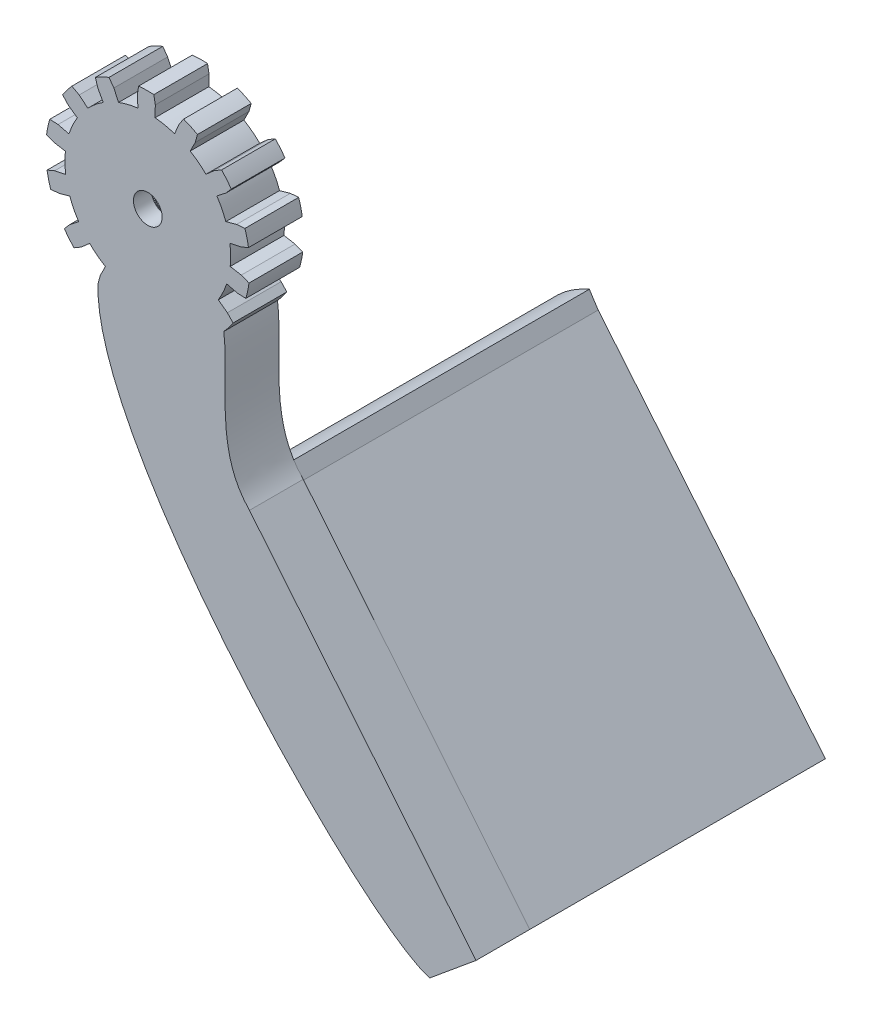
from build123d import *

# Parameters (mm, degrees)
BOSS_EXTRUDE1_DEPTH      = 2
BOSS_EXTRUDE1_DEPTH_BACK = 4
SKETCH3_R                = 3.5
BOSS_EXTRUDE2_DEPTH      = 2
BOSS_EXTRUDE3_START      = -6
BOSS_EXTRUDE3_DEPTH      = 6
BOSS_EXTRUDE4_DEPTH      = 33
CUT_EXTRUDE1_DEPTH       = 4
SKETCH8_R                = 1.6
CUT_EXTRUDE2_DEPTH       = 8


with BuildPart() as part:
    # Sketch2 → Boss-Extrude1 (new, two sides: drawn at the far end of the back side and taken through both)
    with BuildSketch(Plane.XY.offset(-BOSS_EXTRUDE1_DEPTH_BACK)):
        with BuildLine():
            Line((17.68781088, 7.309984121), (18.627860573, 8.138033693))
            Line((18.627860573, 8.138033693), (19.430379653, 8.604441903))
            ThreePointArc((19.430379653, 8.604441903), (19.995203762, 7.96839095), (20.511027992, 7.291994282))
            Line((20.511027992, 7.291994282), (19.899268666, 6.593908315))
            Line((19.899268666, 6.593908315), (18.906195626, 5.830255607))
            ThreePointArc((18.906195626, 5.830255607), (19.464749307, 4.865356726), (19.903157697, 3.840266414))
            Line((19.903157697, 3.840266414), (21.109390449, 4.178441024))
            Line((21.109390449, 4.178441024), (22.034802094, 4.250460322))
            ThreePointArc((22.034802094, 4.250460322), (22.267718866, 3.432330219), (22.438982924, 2.599110133))
            Line((22.438982924, 2.599110133), (21.584918666, 2.235588834))
            Line((21.584918666, 2.235588834), (20.358854282, 1.978439762))
            ThreePointArc((20.358854282, 1.978439762), (20.443439825, 0.86674855), (20.393662118, -0.24704418))
            Line((20.393662118, -0.24704418), (21.62716874, -0.465724161))
            Line((21.62716874, -0.465724161), (22.492183824, -0.80235808))
            ThreePointArc((22.492183824, -0.80235808), (22.347061236, -1.640526633), (22.139844174, -2.465540681))
            Line((22.139844174, -2.465540681), (21.212632886, -2.42249746))
            Line((21.212632886, -2.42249746), (19.996414245, -2.12221137))
            ThreePointArc((19.996414245, -2.12221137), (19.590278446, -3.160510834), (19.062173728, -4.142405671))
            Line((19.062173728, -4.142405671), (20.078643104, -4.874627991))
            Line((20.078643104, -4.874627991), (20.711934781, -5.553240651))
            ThreePointArc((20.711934781, -5.553240651), (20.217516142, -6.245438093), (19.672859841, -6.898841951))
            Line((19.672859841, -6.898841951), (18.85614709, -6.457759449))
            Line((18.85614709, -6.457759449), (17.89066121, -5.659513538))
            ThreePointArc((17.89066121, -5.659513538), (17.074244245, -6.418773312), (16.172410131, -7.074293942))
            Line((16.172410131, -7.074293942), (16.770518037, -8.175032991))
            Line((16.770518037, -8.175032991), (17.046655123, -9.061216832))
            ThreePointArc((17.046655123, -9.061216832), (16.300866108, -9.470344969), (15.526646427, -9.822723991))
            Line((15.526646427, -9.822723991), (14.98219219, -9.070964007))
            Line((14.98219219, -9.070964007), (14.45866539, -7.932860668))
            ThreePointArc((14.45866539, -7.932860668), (13.393668651, -8.262700042), (12.296724449, -8.462012564))
            Line((12.296724449, -8.462012564), (12.358008277, -9.713253473))
            Line((12.358008277, -9.713253473), (12.222298437, -10.631488917))
            ThreePointArc((12.222298437, -10.631488917), (11.372851706, -10.676514905), (10.52241235, -10.658076103))
            Line((10.52241235, -10.658076103), (10.358052465, -9.744533921))
            Line((10.358052465, -9.744533921), (10.380175648, -8.491988479))
            ThreePointArc((10.380175648, -8.491988479), (9.277534802, -8.327078719), (8.202743763, -8.030706845))
            Line((8.202743763, -8.030706845), (7.7150655, -9.184626007))
            Line((7.7150655, -9.184626007), (7.194387732, -9.953045262))
            ThreePointArc((7.194387732, -9.953045262), (6.409526628, -9.625051151), (5.65130754, -9.239446557))
            Line((5.65130754, -9.239446557), (5.899595498, -8.34506041))
            Line((5.899595498, -8.34506041), (6.462986898, -7.226154851))
            ThreePointArc((6.462986898, -7.226154851), (5.541093486, -6.599158358), (4.701331158, -5.865802171))
            Line((4.701331158, -5.865802171), (3.761281465, -6.693851744))
            Line((3.761281465, -6.693851744), (2.958762386, -7.160259953))
            ThreePointArc((2.958762386, -7.160259953), (2.393938277, -6.524209001), (1.878114046, -5.847812333))
            Line((1.878114046, -5.847812333), (2.489873373, -5.149726366))
            Line((2.489873373, -5.149726366), (3.482946412, -4.386073658))
            ThreePointArc((3.482946412, -4.386073658), (2.924392731, -3.421174777), (2.485984341, -2.396084465))
            Line((2.485984341, -2.396084465), (1.279751589, -2.734259075))
            Line((1.279751589, -2.734259075), (0.354339945, -2.806278373))
            ThreePointArc((0.354339945, -2.806278373), (0.121423172, -1.98814827), (-0.049840885, -1.154928184))
            Line((-0.049840885, -1.154928184), (0.804223372, -0.791406885))
            Line((0.804223372, -0.791406885), (2.030287756, -0.534257812))
            ThreePointArc((2.030287756, -0.534257812), (1.945702213, 0.577433399), (1.99547992, 1.691226129))
            Line((1.99547992, 1.691226129), (0.761973298, 1.90990611))
            Line((0.761973298, 1.90990611), (-0.103041785, 2.24654003))
            ThreePointArc((-0.103041785, 2.24654003), (0.042080802, 3.084708583), (0.249297864, 3.90972263))
            Line((0.249297864, 3.90972263), (1.176509152, 3.86667941))
            Line((1.176509152, 3.86667941), (2.392727793, 3.566393319))
            ThreePointArc((2.392727793, 3.566393319), (2.798863592, 4.604692783), (3.32696831, 5.58658762))
            Line((3.32696831, 5.58658762), (2.310498934, 6.31880994))
            Line((2.310498934, 6.31880994), (1.677207257, 6.9974226))
            ThreePointArc((1.677207257, 6.9974226), (2.171625896, 7.689620042), (2.716282197, 8.3430239))
            Line((2.716282197, 8.3430239), (3.532994948, 7.901941399))
            Line((3.532994948, 7.901941399), (4.498480829, 7.103695488))
            ThreePointArc((4.498480829, 7.103695488), (5.314897794, 7.862955261), (6.216731907, 8.518475892))
            Line((6.216731907, 8.518475892), (5.618624002, 9.61921494))
            Line((5.618624002, 9.61921494), (5.342486915, 10.505398781))
            ThreePointArc((5.342486915, 10.505398781), (6.088275931, 10.914526918), (6.862495611, 11.26690594))
            Line((6.862495611, 11.26690594), (7.406949848, 10.515145956))
            Line((7.406949848, 10.515145956), (7.930476649, 9.377042617))
            ThreePointArc((7.930476649, 9.377042617), (8.995473387, 9.706881991), (10.092417589, 9.906194514))
            Line((10.092417589, 9.906194514), (10.031133761, 11.157435422))
            Line((10.031133761, 11.157435422), (10.166843601, 12.075670866))
            ThreePointArc((10.166843601, 12.075670866), (11.016290332, 12.120696854), (11.866729689, 12.102258053))
            Line((11.866729689, 12.102258053), (12.031089574, 11.18871587))
            Line((12.031089574, 11.18871587), (12.00896639, 9.936170428))
            ThreePointArc((12.00896639, 9.936170428), (13.111607236, 9.771260668), (14.186398275, 9.474888794))
            Line((14.186398275, 9.474888794), (14.674076538, 10.628807956))
            Line((14.674076538, 10.628807956), (15.194754306, 11.397227211))
            ThreePointArc((15.194754306, 11.397227211), (15.97961541, 11.069233101), (16.737834498, 10.683628507))
            Line((16.737834498, 10.683628507), (16.48954654, 9.789242359))
            Line((16.48954654, 9.789242359), (15.92615514, 8.6703368))
            ThreePointArc((15.92615514, 8.6703368), (16.848048552, 8.043340307), (17.68781088, 7.309984121))
        make_face()
    extrude(amount=BOSS_EXTRUDE1_DEPTH + BOSS_EXTRUDE1_DEPTH_BACK)

    # Sketch3 → Boss-Extrude2 (add)
    with BuildSketch(Plane.XY.offset(2)):
        with Locations((11.194571019, 0)):
            Circle(SKETCH3_R)
    extrude(amount=-BOSS_EXTRUDE2_DEPTH)

    # Sketch5 → Boss-Extrude3 (add)
    with BuildSketch(Plane.XY.offset(2).offset(BOSS_EXTRUDE3_START)):
        with BuildLine():
            Line((22.542404023, -22.747020906), (47.835171183, -53.618399108))
            Line((47.835171183, -53.618399108), (42.65918527, -57.902143879))
            add(Edge.make_bspline(
                [(42.65918527, -57.902143879), (34.794811104, -55.712489154), (4.891267532, -24.238927446), (5.65130754, -9.239446557)],
                knots=[0.222415535, 0.222415535, 0.222415535, 0.222415535, 1, 1, 1, 1], degree=3))
            ThreePointArc((5.65130754, -9.239446557), (6.409526628, -9.625051151), (7.194387732, -9.953045262))
            Line((7.194387732, -9.953045262), (7.7150655, -9.184626007))
            Line((7.7150655, -9.184626007), (8.202743763, -8.030706845))
            ThreePointArc((8.202743763, -8.030706845), (9.277534802, -8.327078719), (10.380175648, -8.491988479))
            Line((10.380175648, -8.491988479), (10.358052465, -9.744533921))
            Line((10.358052465, -9.744533921), (10.52241235, -10.658076103))
            ThreePointArc((10.52241235, -10.658076103), (11.372851706, -10.676514905), (12.222298437, -10.631488917))
            Line((12.222298437, -10.631488917), (12.358008277, -9.713253473))
            Line((12.358008277, -9.713253473), (12.296724449, -8.462012564))
            ThreePointArc((12.296724449, -8.462012564), (13.393668651, -8.262700042), (14.45866539, -7.932860668))
            Line((14.45866539, -7.932860668), (14.98219219, -9.070964007))
            Line((14.98219219, -9.070964007), (15.526646427, -9.822723991))
            ThreePointArc((15.526646427, -9.822723991), (16.300866108, -9.470344969), (17.046655123, -9.061216832))
            Line((17.046655123, -9.061216832), (16.770518037, -8.175032991))
            Line((16.770518037, -8.175032991), (16.172410131, -7.074293942))
            ThreePointArc((16.172410131, -7.074293942), (17.074244245, -6.418773312), (17.89066121, -5.659513538))
            Line((17.89066121, -5.659513538), (18.85614709, -6.457759449))
            Line((18.85614709, -6.457759449), (19.672859841, -6.898841951))
            add(Edge.make_bspline(
                [(19.672859841, -6.898841951), (20.322867091, -11.683356686), (18.562502786, -18.688266362), (22.542404023, -22.747020906)],
                knots=[0, 0, 0, 0, 1, 1, 1, 1], degree=3))
        make_face()
    extrude(amount=BOSS_EXTRUDE3_DEPTH)

    # Sketch6 → Boss-Extrude4 (add)
    with BuildSketch(Plane(origin=(0, 0, -4), x_dir=(-1, 0, 0), z_dir=(0, 0, -1))):
        with BuildLine():
            Line((-47.835171183, -53.618399108), (-22.469898408, -22.92528889))
            Line((-22.469898408, -22.92528889), (-21.484256134, -21.405340801))
            add(Edge.make_bspline(
                [(-21.484256134, -21.405340801), (-15.460770385, -24.043546847), (-14.934229825, -30.624048993)],
                knots=[0, 0, 0, 1, 1, 1], degree=2))
            add(Edge.make_bspline(
                [(-42.65918527, -57.902143879), (-37.740593552, -56.532674756), (-24.201184644, -43.708544884), (-14.934229825, -30.624048993)],
                knots=[0.222415535, 0.222415535, 0.222415535, 0.222415535, 0.708737832, 0.708737832, 0.708737832, 0.708737832], degree=3))
            Line((-42.65918527, -57.902143879), (-47.835171183, -53.618399108))
        make_face()
    extrude(amount=BOSS_EXTRUDE4_DEPTH)

    # Sketch7 → Cut-Extrude1 (cut)
    with BuildSketch(Plane(origin=(0, 0, -4), x_dir=(-1, 0, 0), z_dir=(0, 0, -1))):
        Polygon((-13.207057808, 2.867806466), (-13.172917327, 2.703541424), (-13.33711561, 2.738001552), (-13.29272821, 2.576204348), (-13.458766254, 2.600286381), (-13.404307112, 2.441595556), (-13.571529641, 2.455204453), (-13.507213682, 2.300246285), (-13.674960745, 2.303328339), (-13.601041796, 2.152714379), (-13.768651372, 2.145257426), (-13.685421156, 1.999582076), (-13.852231767, 1.981615546), (-13.760018756, 1.841453722), (-13.925372077, 1.813048519), (-13.824540193, 1.678953375), (-13.98778365, 1.640221603), (-13.878730831, 1.512722352), (-14.039220176, 1.463816866), (-13.922376803, 1.343416689), (-14.079478658, 1.284530498), (-13.95530586, 1.171704559), (-14.108400216, 1.103070059), (-13.977388045, 0.99826363), (-14.125870708, 0.920151691), (-13.988536209, 0.823778397), (-14.131821186, 0.736497289), (-13.988706357, 0.64893747), (-14.126228168, 0.552831654), (-13.977897817, 0.474430869), (-14.109113725, 0.36987963), (-13.956153244, 0.300947291), (-14.080545402, 0.188363245), (-13.923558455, 0.129171395), (-14.040635943, 0.00899886), (-13.880242087, -0.040218896), (-13.989542853, -0.167505654), (-13.82637509, -0.206555076), (-13.927467774, -0.340453716), (-13.762170052, -0.369180694), (-13.854655687, -0.509162777), (-13.68788036, -0.527453939), (-13.771393949, -0.672967021), (-13.603799203, -0.68075018), (-13.678011155, -0.831219986), (-13.510258411, -0.828464427), (-13.574875845, -0.983297122), (-13.407627145, -0.970013718), (-13.462395046, -1.128598248), (-13.296310446, -1.104839423), (-13.34101267, -1.266549928), (-13.176747628, -1.232409447), (-13.211207756, -1.396607729), (-13.049410552, -1.352220329), (-13.073492585, -1.518258373), (-12.914801759, -1.463799231), (-12.928410657, -1.63102176), (-12.773452489, -1.566705802), (-12.776534543, -1.734452865), (-12.625920582, -1.660533915), (-12.618463629, -1.828143492), (-12.47278828, -1.744913276), (-12.454821749, -1.911723887), (-12.314659926, -1.819510876), (-12.286254723, -1.984864197), (-12.152159579, -1.884032313), (-12.113427807, -2.047275769), (-11.985928555, -1.93822295), (-11.93702307, -2.098712295), (-11.816622893, -1.981868923), (-11.757736701, -2.138970778), (-11.644910762, -2.01479798), (-11.576276262, -2.167892335), (-11.471469834, -2.036880164), (-11.393357895, -2.185362827), (-11.2969846, -2.048028329), (-11.209703493, -2.191313306), (-11.122143674, -2.048198477), (-11.026037858, -2.185720288), (-10.947637073, -2.037389936), (-10.843085834, -2.168605845), (-10.774153494, -2.015645364), (-10.661569448, -2.140037521), (-10.602377599, -1.983050575), (-10.482205064, -2.100128063), (-10.432987308, -1.939734207), (-10.305700549, -2.049034973), (-10.266651127, -1.88586721), (-10.132752488, -1.986959894), (-10.10402551, -1.821662171), (-9.964043427, -1.914147807), (-9.945752264, -1.74737248), (-9.800239183, -1.830886069), (-9.792456023, -1.663291323), (-9.641986217, -1.737503275), (-9.644741777, -1.56975053), (-9.489909082, -1.634367964), (-9.503192486, -1.467119265), (-9.344607956, -1.521887166), (-9.368366781, -1.355802565), (-9.206656276, -1.400504789), (-9.240796757, -1.236239748), (-9.076598474, -1.270699875), (-9.120985874, -1.108902672), (-8.95494783, -1.132984705), (-9.009406972, -0.974293879), (-8.842184443, -0.987902777), (-8.906500402, -0.832944609), (-8.738753339, -0.836026663), (-8.812672288, -0.685412702), (-8.645062712, -0.677955749), (-8.728292928, -0.5322804), (-8.561482317, -0.514313869), (-8.653695328, -0.374152045), (-8.488342007, -0.345746842), (-8.589173891, -0.211651699), (-8.425930434, -0.172919926), (-8.534983253, -0.045420675), (-8.374493908, 0.003484811), (-8.491337281, 0.123884988), (-8.334235426, 0.182771179), (-8.458408224, 0.295597118), (-8.305313868, 0.364231618), (-8.436326039, 0.469038046), (-8.287843376, 0.547149986), (-8.425177875, 0.64352328), (-8.281892898, 0.730804387), (-8.425007727, 0.818364206), (-8.287485916, 0.914470022), (-8.435816268, 0.992870808), (-8.304600359, 1.097422047), (-8.45756084, 1.166354386), (-8.333168682, 1.278938432), (-8.490155629, 1.338130281), (-8.373078141, 1.458302817), (-8.533471997, 1.507520572), (-8.424171231, 1.634807331), (-8.587338994, 1.673856753), (-8.48624631, 1.807755392), (-8.651544032, 1.836482371), (-8.559058397, 1.976464454), (-8.725833724, 1.994755616), (-8.642320135, 2.140268697), (-8.809914881, 2.148051857), (-8.735702929, 2.298521663), (-8.903455673, 2.295766103), (-8.838838239, 2.450598799), (-9.006086939, 2.437315394), (-8.951319038, 2.595899925), (-9.117403638, 2.572141099), (-9.072701414, 2.733851605), (-9.236966456, 2.699711124), (-9.202506328, 2.863909406), (-9.364303532, 2.819522006), (-9.340221499, 2.98556005), (-9.498912325, 2.931100908), (-9.485303427, 3.098323437), (-9.640261595, 3.034007478), (-9.637179541, 3.201754542), (-9.787793502, 3.127835592), (-9.795250455, 3.295445169), (-9.940925804, 3.212214952), (-9.958892335, 3.379025564), (-10.099054159, 3.286812552), (-10.127459361, 3.452165873), (-10.261554505, 3.351333989), (-10.300286278, 3.514577446), (-10.427785529, 3.405524627), (-10.476691014, 3.566013972), (-10.597091192, 3.4491706), (-10.655977383, 3.606272454), (-10.768803322, 3.482099656), (-10.837437822, 3.635194012), (-10.94224425, 3.504181841), (-11.020356189, 3.652664504), (-11.116729484, 3.515330006), (-11.204010591, 3.658614983), (-11.29157041, 3.515500153), (-11.387676226, 3.653021964), (-11.466077011, 3.504691613), (-11.57062825, 3.635907522), (-11.63956059, 3.48294704), (-11.752144636, 3.607339198), (-11.811336485, 3.450352252), (-11.93150902, 3.567429739), (-11.980726776, 3.407035884), (-12.108013535, 3.51633665), (-12.147062957, 3.353168886), (-12.280961596, 3.45426157), (-12.309688574, 3.288963848), (-12.449670657, 3.381449484), (-12.46796182, 3.214674157), (-12.613474901, 3.298187745), (-12.621258061, 3.130593), (-12.771727867, 3.204804951), (-12.768972307, 3.037052207), (-12.923805002, 3.101669641), (-12.910521598, 2.934420942), (-13.069106129, 2.989188843), (-13.045347303, 2.823104242), align=None)
    extrude(amount=-CUT_EXTRUDE1_DEPTH, mode=Mode.SUBTRACT)

    # Sketch8 → Cut-Extrude2 (cut)
    with BuildSketch(Plane(origin=(0, 0, -4), x_dir=(-1, 0, 0), z_dir=(0, 0, -1))):
        with Locations(Location((-11.194571019, 0.722090975, 0), (0, 0, 180))):
            Circle(SKETCH8_R)
    extrude(amount=-CUT_EXTRUDE2_DEPTH, mode=Mode.SUBTRACT)


solid = part.part
